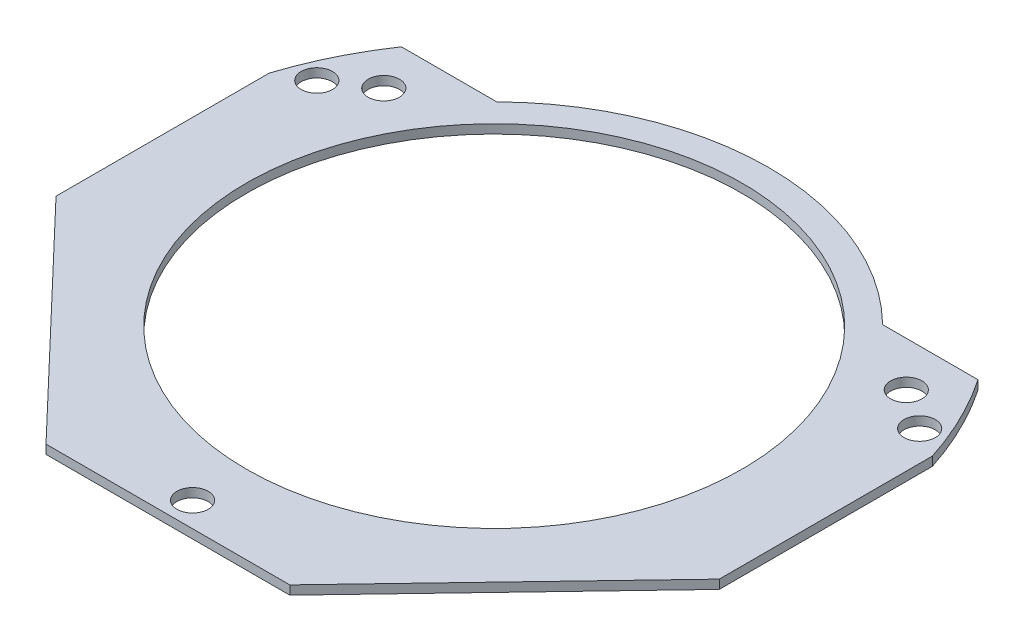
from build123d import *

# Parameters (mm, degrees)
SKETCH_1_R          = 39
EXTRUDE_1_DEPTH     = 1
SKETCH_2_R          = 1.75
CUT_EXTRUDE_1_DEPTH = 1
SKETCH_3_R          = 27.75
CUT_EXTRUDE_2_DEPTH = 1
SKETCH_4_R          = 1.75
CUT_EXTRUDE_3_DEPTH = 1
CUT_EXTRUDE_4_DEPTH = 1
CUT_EXTRUDE_5_DEPTH = 1


with BuildPart() as part:
    # 스케치1 → 보스-돌출1 (new body)
    with BuildSketch(Plane(origin=(0, 0, 0), x_dir=(1, 0, 0), z_dir=(0, 1, 0))):
        with Locations(Location((0, 0, 0), (0, 0, 270))):
            Circle(SKETCH_1_R)
    extrude(amount=EXTRUDE_1_DEPTH)

    # 스케치2 → 컷-돌출1 (cut)
    with BuildSketch(Plane(origin=(0, 1, 0), x_dir=(1, 0, 0), z_dir=(0, 1, 0))):
        with Locations(Location((29.25, 16.887495374, 0), (0, 0, 270))):
            Circle(SKETCH_2_R)
        with Locations(Location((-29.25, 16.887495374, 0), (0, 0, 270))):
            Circle(SKETCH_2_R)
        with Locations(Location((0, -33.774990748, 0), (0, 0, 270))):
            Circle(SKETCH_2_R)
    extrude(amount=-CUT_EXTRUDE_1_DEPTH, mode=Mode.SUBTRACT)

    # 스케치3 → 컷-돌출2 (cut)
    with BuildSketch(Plane(origin=(0, 1, 0), x_dir=(1, 0, 0), z_dir=(0, 1, 0))):
        with Locations(Location((0, 0, 0), (0, 0, 270))):
            Circle(SKETCH_3_R)
    extrude(amount=-CUT_EXTRUDE_2_DEPTH, mode=Mode.SUBTRACT)

    # 스케치4 → 컷-돌출3 (cut)
    with BuildSketch(Plane(origin=(0, 1, 0), x_dir=(1, 0, 0), z_dir=(0, 1, 0))):
        with Locations(Location((33.75, 13.887495374, 0), (0, 0, 270))):
            Circle(SKETCH_4_R)
        with Locations(Location((-33.75, 13.887495374, 0), (0, 0, 90))):
            Circle(SKETCH_4_R)
    extrude(amount=-CUT_EXTRUDE_3_DEPTH, mode=Mode.SUBTRACT)

    # 스케치5 → 컷-돌출4 (cut)
    with BuildSketch(Plane(origin=(0, 1, 0), x_dir=(1, 0, 0), z_dir=(0, 1, 0))):
        with BuildLine():
            Line((-41.165274156, 21.887495374), (-21.598612137, 21.887495374))
            ThreePointArc((-21.598612137, 21.887495374), (0, 30.75), (21.598612137, 21.887495374))
            Line((21.598612137, 21.887495374), (39.254048052, 21.887495374))
            Line((39.254048052, 21.887495374), (39.254048052, 46.515320785))
            Line((39.254048052, 46.515320785), (-41.165274156, 46.515320785))
            Line((-41.165274156, 46.515320785), (-41.165274156, 21.887495374))
        make_face()
    extrude(amount=-CUT_EXTRUDE_4_DEPTH, mode=Mode.SUBTRACT)

    # 스케치6 → 컷-돌출5 (cut)
    with BuildSketch(Plane(origin=(0, 1, 0), x_dir=(1, 0, 0), z_dir=(0, 1, 0))):
        Polygon((37.13022954, 19.961121964), (37.13022954, -11.930886568), (13.650716042, -36.532970746), (-13.650716042, -36.532970746), (-37.13022954, -11.930886568), (-37.13022954, 19.961121964), (-57.208624866, 19.961121964), (-57.208624866, -51.243312927), (54.097642537, -51.243312927), (54.097642537, 19.961121964), align=None)
    extrude(amount=-CUT_EXTRUDE_5_DEPTH, mode=Mode.SUBTRACT)


solid = part.part
